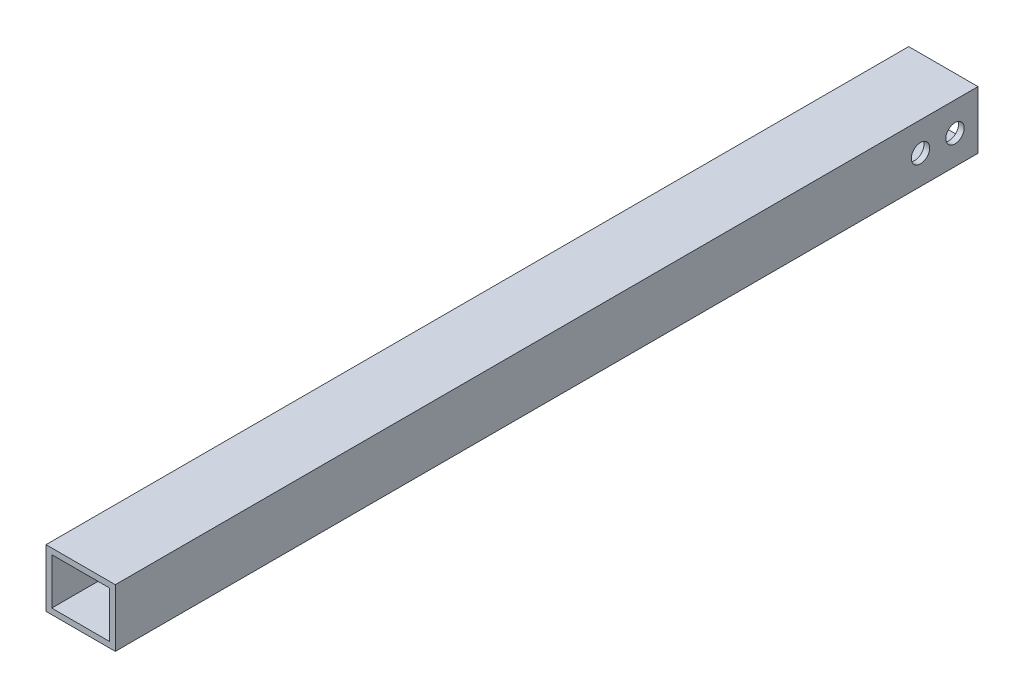
from build123d import *

# Parameters (mm, degrees)
ESQUISSE1_W             = 12.05
ESQUISSE1_H             = 10.05
ESQUISSE1_W_2           = 10.05
ESQUISSE1_H_2           = 8.05
EXTRU_MINCE1_DEPTH      = 150
ENL_V_MAT_EXTRU_1_REACH = 152.818
ESQUISSE2_R             = 1.6
ENL_V_MAT_EXTRU_2_REACH = 152.818
ESQUISSE3_R             = 1.6


with BuildPart() as part:
    # Esquisse1 → Extru.-Mince1 (new body)
    with BuildSketch(Plane.XY):
        with Locations((6.025, 5.025)):
            Rectangle(ESQUISSE1_W, ESQUISSE1_H)
        with Locations((6.025, 5.025)):
            Rectangle(ESQUISSE1_W_2, ESQUISSE1_H_2, mode=Mode.SUBTRACT)
    extrude(amount=EXTRU_MINCE1_DEPTH)

    # Esquisse2 → Enlèv. mat.-Extru.1 (cut, up to next)
    with BuildSketch(Plane(origin=(0, 0, 0), x_dir=(-1, 0, 0), z_dir=(0, -1, 0)), mode=Mode.PRIVATE) as enl_v_mat_extru_1_sk1:
        with Locations(Location((-6.025, -80, 0), (0, 0, 90))):
            Circle(ESQUISSE2_R)
    enl_v_mat_extru_1_tool1 = extrude(enl_v_mat_extru_1_sk1.sketch, amount=-ENL_V_MAT_EXTRU_1_REACH, mode=Mode.PRIVATE) & part.part
    add(enl_v_mat_extru_1_tool1.solids().sort_by_distance((6.025, 0, 80))[0], mode=Mode.SUBTRACT)

    # Esquisse3 → Enlèv. mat.-Extru.2 (cut, up to next)
    with BuildSketch(Plane(origin=(12.05, 0, 0), x_dir=(0, 0, -1), z_dir=(1, 0, 0)), mode=Mode.PRIVATE) as enl_v_mat_extru_2_sk1:
        with Locations((-4, 5.025)):
            Circle(ESQUISSE3_R)
    enl_v_mat_extru_2_tool1 = extrude(enl_v_mat_extru_2_sk1.sketch, amount=-ENL_V_MAT_EXTRU_2_REACH, mode=Mode.PRIVATE) & part.part
    # Esquisse3 → Enlèv. mat.-Extru.2 (cut, up to next)
    with BuildSketch(Plane(origin=(12.05, 0, 0), x_dir=(0, 0, -1), z_dir=(1, 0, 0)), mode=Mode.PRIVATE) as enl_v_mat_extru_2_sk2:
        with Locations((-10, 5.025)):
            Circle(ESQUISSE3_R)
    enl_v_mat_extru_2_tool2 = extrude(enl_v_mat_extru_2_sk2.sketch, amount=-ENL_V_MAT_EXTRU_2_REACH, mode=Mode.PRIVATE) & part.part
    add(enl_v_mat_extru_2_tool1.solids().sort_by_distance((12.05, 5.025, 4))[0], mode=Mode.SUBTRACT)
    add(enl_v_mat_extru_2_tool2.solids().sort_by_distance((12.05, 5.025, 10))[0], mode=Mode.SUBTRACT)


solid = part.part
